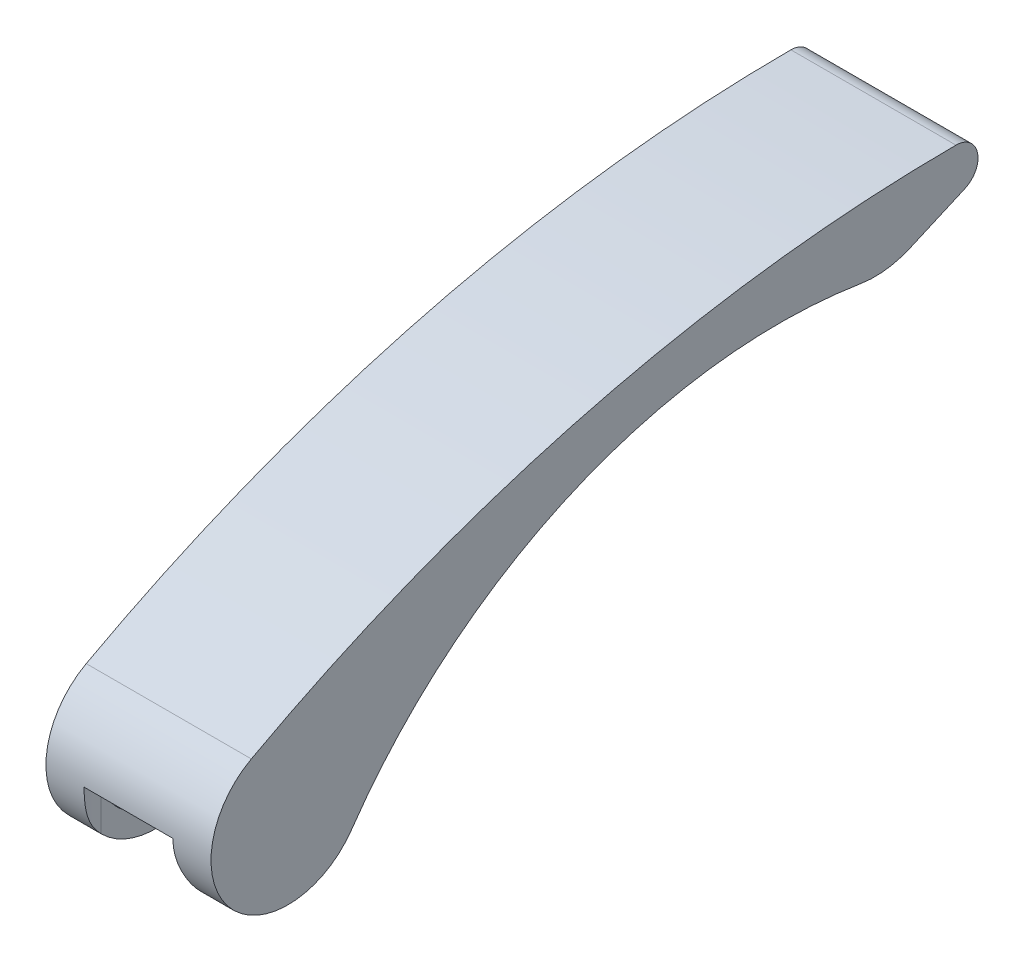
from build123d import *

# Parameters (mm, degrees)
SKETCH4_R           = 2.5
BOSS_EXTRUDE2_DEPTH = 7.5
CUT_EXTRUDE1_DEPTH  = 35.126684354
SKETCH4_4_R         = 2.5
BOSS_EXTRUDE4_DEPTH = 0.5
BOSS_EXTRUDE5_START = 7
SKETCH4_5_R         = 2.5
BOSS_EXTRUDE5_DEPTH = 0.5


with BuildPart() as part:
    # Sketch4 → Boss-Extrude2 (new body)
    with BuildSketch(Plane(origin=(0, 0, 0), x_dir=(0, 0, -1), z_dir=(1, 0, 0))):
        with BuildLine():
            ThreePointArc((26.035044154, 7.931278408), (27.172885501, 7.913960675), (28.269557121, 8.217760269))
            Line((28.269557121, 8.217760269), (30.746429201, 9.303054261))
            ThreePointArc((30.746429201, 9.303054261), (31.323725134, 10.424611444), (30.343861951, 11.218984941))
            ThreePointArc((30.343861951, 11.218984941), (13.830620655, 9.141504786), (-1.66846042, 3.076725504))
            ThreePointArc((-1.66846042, 3.076725504), (-2.603150363, -2.33957436), (2.881836513, -1.986207016))
            ThreePointArc((2.881836513, -1.986207016), (13.025423778, 6.31803392), (26.035044154, 7.931278408))
        make_face()
        Circle(SKETCH4_R, mode=Mode.SUBTRACT)
    extrude(amount=BOSS_EXTRUDE2_DEPTH)

    # Sketch5 → Cut-Extrude1 (cut, through all)
    with BuildSketch(Plane(origin=(0, 0, 0), x_dir=(1, 0, 0), z_dir=(0, 1, 0))):
        with BuildLine():
            Line((1.5, 2.5), (1.5, -2.5))
            ThreePointArc((1.5, -2.5), (3.75, -4.75), (6, -2.5))
            Line((6, -2.5), (6, 2.5))
            ThreePointArc((6, 2.5), (3.75, 4.75), (1.5, 2.5))
        make_face()
    extrude(amount=-CUT_EXTRUDE1_DEPTH, mode=Mode.SUBTRACT)

    # Sketch4<4> → Boss-Extrude4 (add)
    with BuildSketch(Plane(origin=(0, 0, 0), x_dir=(0, 0, -1), z_dir=(1, 0, 0))):
        Circle(SKETCH4_4_R)
    extrude(amount=BOSS_EXTRUDE4_DEPTH)

    # Sketch4<5> → Boss-Extrude5 (add)
    with BuildSketch(Plane(origin=(0, 0, 0), x_dir=(0, 0, -1), z_dir=(1, 0, 0)).offset(BOSS_EXTRUDE5_START)):
        Circle(SKETCH4_5_R)
    extrude(amount=BOSS_EXTRUDE5_DEPTH)


solid = part.part
